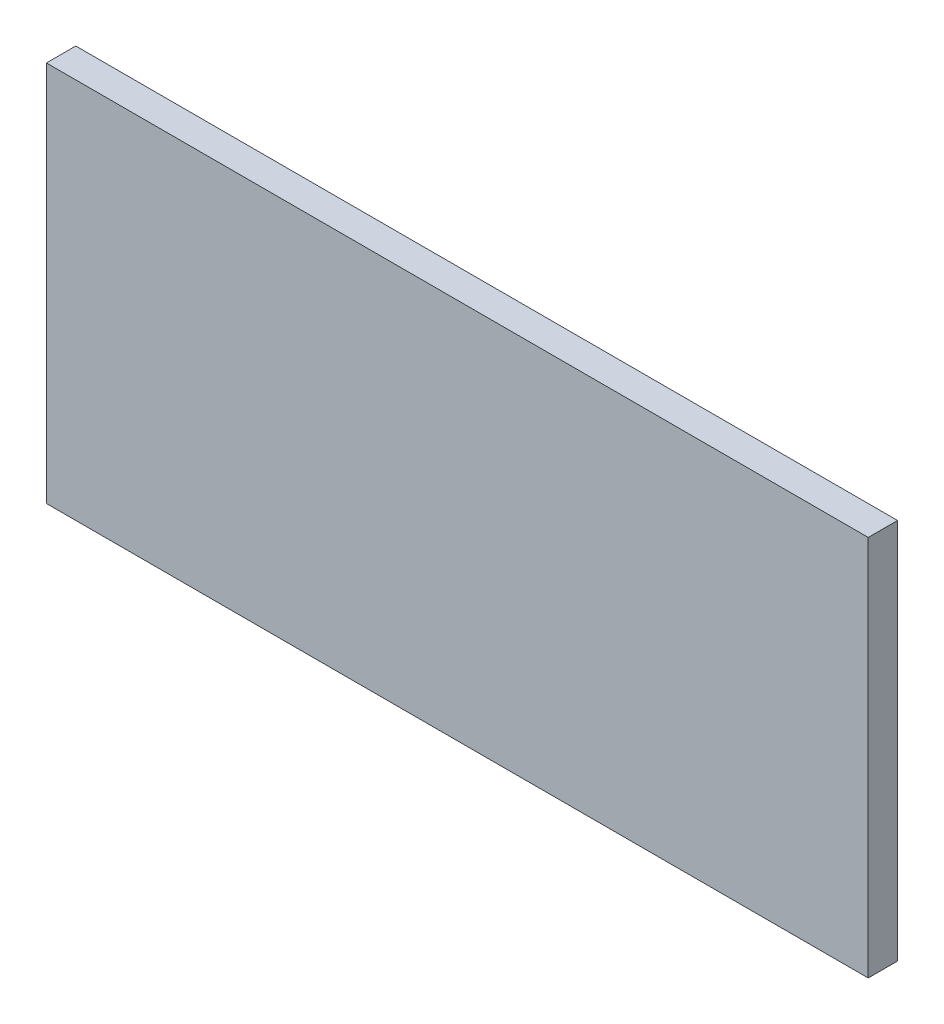
from build123d import *

# Parameters (mm, degrees)
SKIZZE1_W                       = 28
SKIZZE1_H                       = 13
AUFSATZ_LINEAR_AUSTRAGEN1_DEPTH = 1


with BuildPart() as part:
    # Skizze1 → Aufsatz-Linear austragen1 (new body)
    with BuildSketch(Plane.XY):
        with Locations((0, -0.5)):
            Rectangle(SKIZZE1_W, SKIZZE1_H)
    extrude(amount=AUFSATZ_LINEAR_AUSTRAGEN1_DEPTH)


solid = part.part
